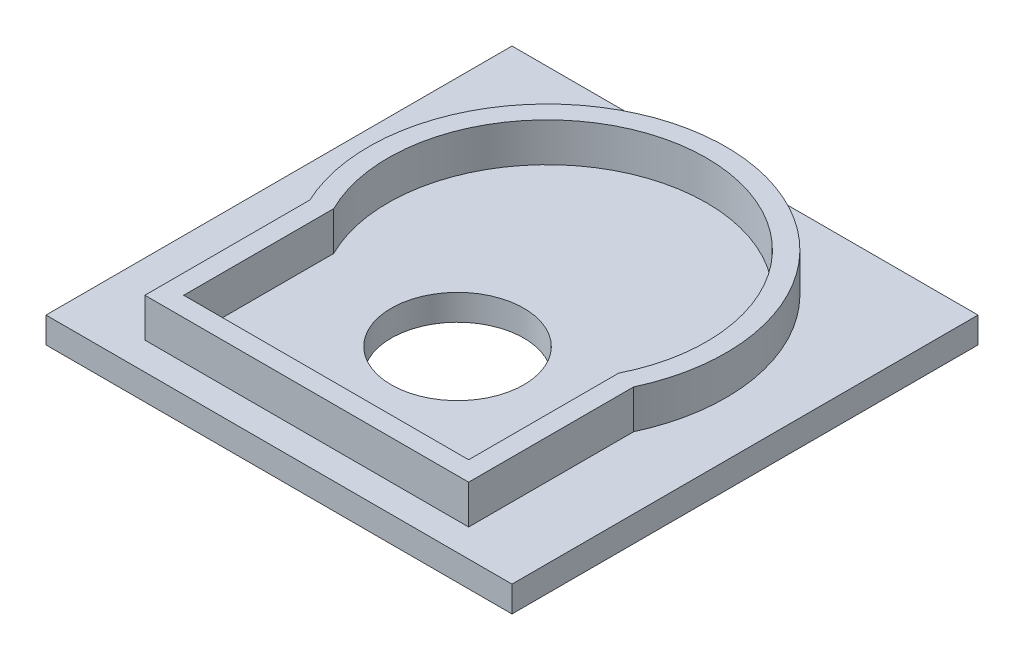
from build123d import *

# Parameters (mm, degrees)
SKETCH1_W           = 152.4
SKETCH1_H           = 152.4
BOSS_EXTRUDE1_DEPTH = 8.466666667
SKETCH2_R           = 5.08
CUT_EXTRUDE1_DEPTH  = 6.35
BOSS_EXTRUDE3_DEPTH = 12.7
SKETCH4_R           = 21.697410495
CUT_EXTRUDE2_DEPTH  = 12.7


with BuildPart() as part:
    # Sketch1 → Boss-Extrude1 (new body)
    with BuildSketch(Plane(origin=(0, 0, 0), x_dir=(1, 0, 0), z_dir=(0, 1, 0))):
        Rectangle(SKETCH1_W, SKETCH1_H)
    extrude(amount=BOSS_EXTRUDE1_DEPTH)

    # Sketch2 → Cut-Extrude1 (cut)
    with BuildSketch(Plane(origin=(0, 0, 0), x_dir=(-1, 0, 0), z_dir=(0, -1, 0))):
        with Locations(Location((61.345958621, 44.67327441, 0), (0, 0, 90))):
            Circle(SKETCH2_R)
        with Locations(Location((0, -61.127341862, 0), (0, 0, 90))):
            Circle(SKETCH2_R)
        with Locations(Location((-61.729425139, 44.45, 0), (0, 0, 90))):
            Circle(SKETCH2_R)
    extrude(amount=-CUT_EXTRUDE1_DEPTH, mode=Mode.SUBTRACT)

    # Sketch3 → Boss-Extrude3 (add)
    with BuildSketch(Plane(origin=(0, 8.466666667, 0), x_dir=(1, 0, 0), z_dir=(0, 1, 0))):
        with BuildLine():
            Line((-52.940598994, -13.15996673), (-52.940598994, -67.121640926))
            Line((-52.940598994, -67.121640926), (52.940598994, -67.121640926))
            Line((52.940598994, -67.121640926), (52.940598994, -13.15996673))
            ThreePointArc((52.940598994, -13.15996673), (0, 69.962044891), (-52.940598994, -13.15996673))
        make_face()
        with BuildLine():
            Line((-46.590598994, -11.708782736), (-46.590598994, -60.771640926))
            Line((-46.590598994, -60.771640926), (46.590598994, -60.771640926))
            Line((46.590598994, -60.771640926), (46.590598994, -11.708782736))
            ThreePointArc((46.590598994, -11.708782736), (0, 63.612044891), (-46.590598994, -11.708782736))
        make_face(mode=Mode.SUBTRACT)
    extrude(amount=BOSS_EXTRUDE3_DEPTH)

    # Sketch4 → Cut-Extrude2 (cut)
    with BuildSketch(Plane(origin=(0, 8.466666667, 0), x_dir=(1, 0, 0), z_dir=(0, 1, 0))):
        with Locations(Location((0, -17.813493045, 0), (0, 0, 270))):
            Circle(SKETCH4_R)
    extrude(amount=-CUT_EXTRUDE2_DEPTH, mode=Mode.SUBTRACT)


solid = part.part
